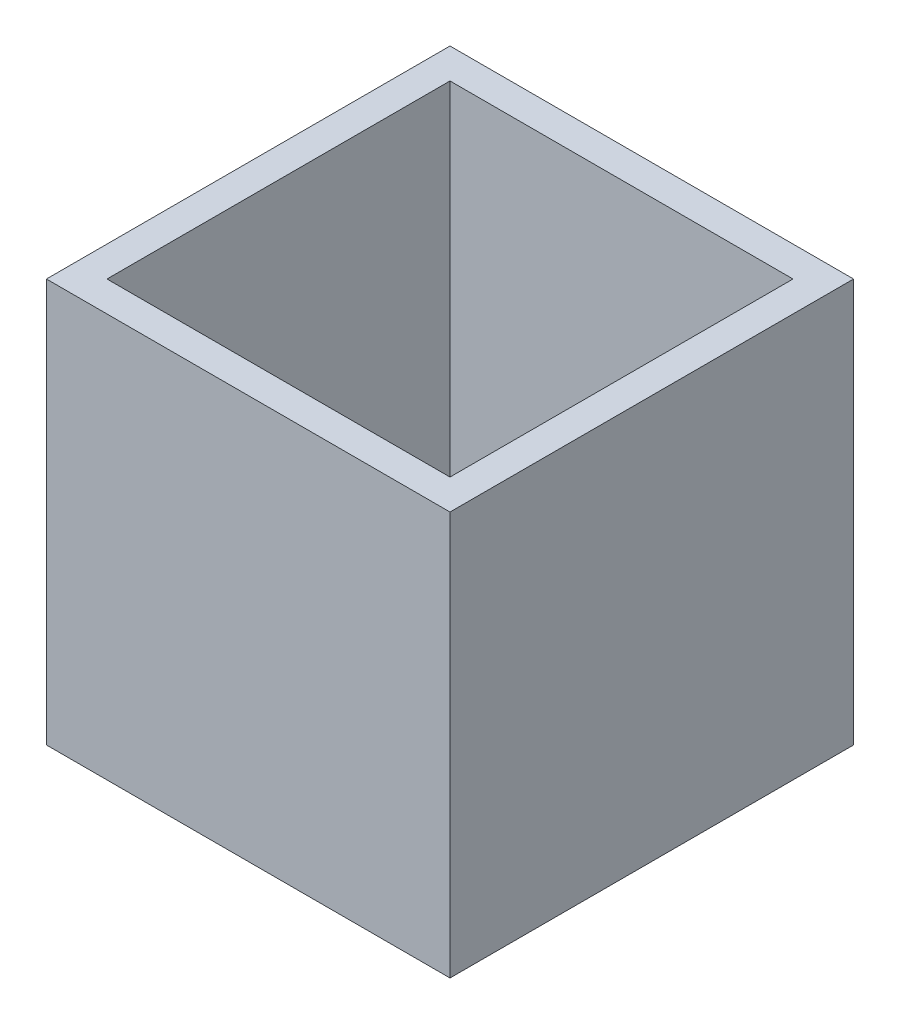
from build123d import *

# Parameters (mm, degrees)
SKETCH1_W           = 20
SKETCH1_H           = 20
BOSS_EXTRUDE1_DEPTH = 20
SHELL1_T            = -1.5
SKETCH2_R           = 5
SKETCH2_R_2         = 0.75
SKETCH2_R_3         = 3
CUT_EXTRUDE1_DEPTH  = 35.641016151


with BuildPart() as part:
    # Sketch1 → Boss-Extrude1 (new body)
    with BuildSketch(Plane(origin=(0, 0, 0), x_dir=(1, 0, 0), z_dir=(0, 1, 0))):
        with Locations((-10, 10)):
            Rectangle(SKETCH1_W, SKETCH1_H)
    extrude(amount=BOSS_EXTRUDE1_DEPTH)

    # Shell1
    shell1_openings = [part.faces().sort_by_distance(p)[0] for p in [
        (-10, 20, -10),
    ]]
    offset(amount=SHELL1_T, openings=shell1_openings, kind=Kind.INTERSECTION)

    # Sketch2 → Cut-Extrude1 (cut, through all)
    with BuildSketch(Plane.XZ):
        with Locations(Location((-13.147042084, -8.401387365, 0), (0, 0, 270))):
            Circle(SKETCH2_R)
        with Locations(Location((-9.417853088, -15.104070699, 0), (0, 0, 270))):
            Circle(SKETCH2_R_2)
        with Locations(Location((-4.966731055, -11.717786539, 0), (0, 0, 270))):
            Circle(SKETCH2_R_3)
    extrude(amount=-CUT_EXTRUDE1_DEPTH, mode=Mode.SUBTRACT)


solid = part.part
